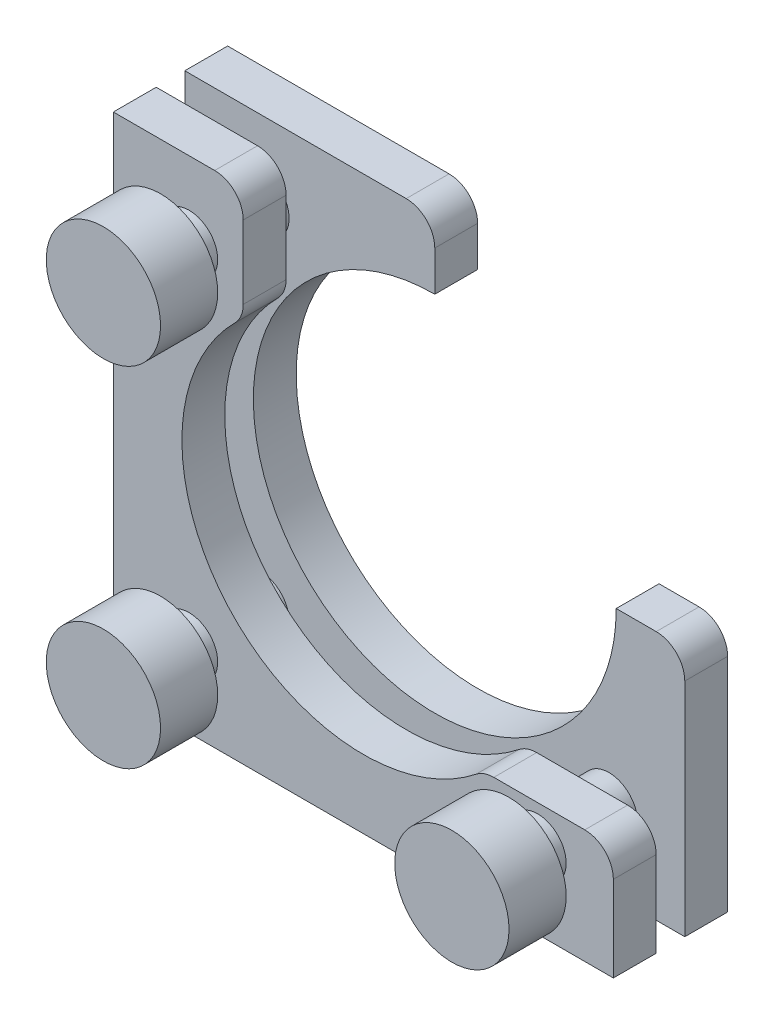
from build123d import *

# Parameters (mm, degrees)
SKETCH_1_W           = 35
SKETCH_1_H           = 35
SKETCH_1_R           = 12.7
EXTRUDE_1_DEPTH      = 3
EXTRUDE_2_DEPTH      = 2
EXTRUDE_2_DEPTH_BACK = 5
SKETCH_2_R           = 2
SKETCH_3_R           = 4
EXTRUDE_3_DEPTH      = 4
EXTRUDE_START        = 3
SKETCH_4_W           = 35
SKETCH_4_H           = 35
SKETCH_4_R           = 12.7
EXTRUDE_4_DEPTH      = 3
SKETCH_5_W           = 51.816122842
SKETCH_5_H           = 54.036228948
CUT_EXTRUDE_1_DEPTH  = 3
SKETCH_7_W           = 35
SKETCH_7_H           = 35
CUT_EXTRUDE_3_DEPTH  = 3
FILLET_1_R           = 2


with BuildPart() as part:
    # 草图1 → 凸台-拉伸1 (new body)
    with BuildSketch(Plane.XY):
        Rectangle(SKETCH_1_W, SKETCH_1_H)
        Circle(SKETCH_1_R, mode=Mode.SUBTRACT)
    extrude(amount=EXTRUDE_1_DEPTH)

    # 草图2 → 凸台-拉伸2 (add, two sides: drawn at the far end of the back side and taken through both)
    with BuildSketch(Plane.XY.offset(3).offset(-EXTRUDE_2_DEPTH_BACK)):
        with Locations((-12.196699141, 12.196699141)):
            Circle(SKETCH_2_R)
        with Locations((12.196699141, -12.196699141)):
            Circle(SKETCH_2_R)
        with Locations((-12.196699141, -12.196699141)):
            Circle(SKETCH_2_R)
    extrude(amount=EXTRUDE_2_DEPTH + EXTRUDE_2_DEPTH_BACK)

    # 草图3 → 凸台-拉伸3 (add)
    with BuildSketch(Plane.XY.offset(5)):
        with Locations((-12.196699141, 12.196699141)):
            Circle(SKETCH_3_R)
        with Locations((-12.196699141, -12.196699141)):
            Circle(SKETCH_3_R)
        with Locations((12.196699141, -12.196699141)):
            Circle(SKETCH_3_R)
    extrude(amount=EXTRUDE_3_DEPTH)

    # 草图4 → 凸台-拉伸4 (add)
    with BuildSketch(Plane(origin=(0, 0, -2), x_dir=(-1, 0, 0), z_dir=(0, 0, -1)).offset(EXTRUDE_START)):
        Rectangle(SKETCH_4_W, SKETCH_4_H)
        with Locations(Location((0, 0, 0), (0, 0, 180))):
            Circle(SKETCH_4_R, mode=Mode.SUBTRACT)
    extrude(amount=-EXTRUDE_4_DEPTH)

    # 草图5 → 切除-拉伸1 (cut)
    with BuildSketch(Plane.XY.offset(3)):
        with Locations((17.5, 17.5)):
            Rectangle(SKETCH_5_W, SKETCH_5_H)
    extrude(amount=-CUT_EXTRUDE_1_DEPTH, mode=Mode.SUBTRACT)

    # 草图7 → 切除-拉伸3 (cut)
    with BuildSketch(Plane(origin=(0, 0, -5), x_dir=(-1, 0, 0), z_dir=(0, 0, -1))):
        with Locations((-17.5, 17.5)):
            Rectangle(SKETCH_7_W, SKETCH_7_H)
    extrude(amount=-CUT_EXTRUDE_3_DEPTH, mode=Mode.SUBTRACT)

    # 圆角1
    fillet_1_edges = [part.edges().sort_by_distance(p)[0] for p in [
        (8.408061421, -9.518114474, 1.5),
        (-8.408061421, 9.518114474, 1.5),
        (-8.408061421, 17.5, 1.5),
        (17.5, -9.518114474, 1.5),
        (0, 17.5, -3.5),
        (17.5, 0, -3.5),
    ]]
    fillet(fillet_1_edges, radius=FILLET_1_R)


solid = part.part
